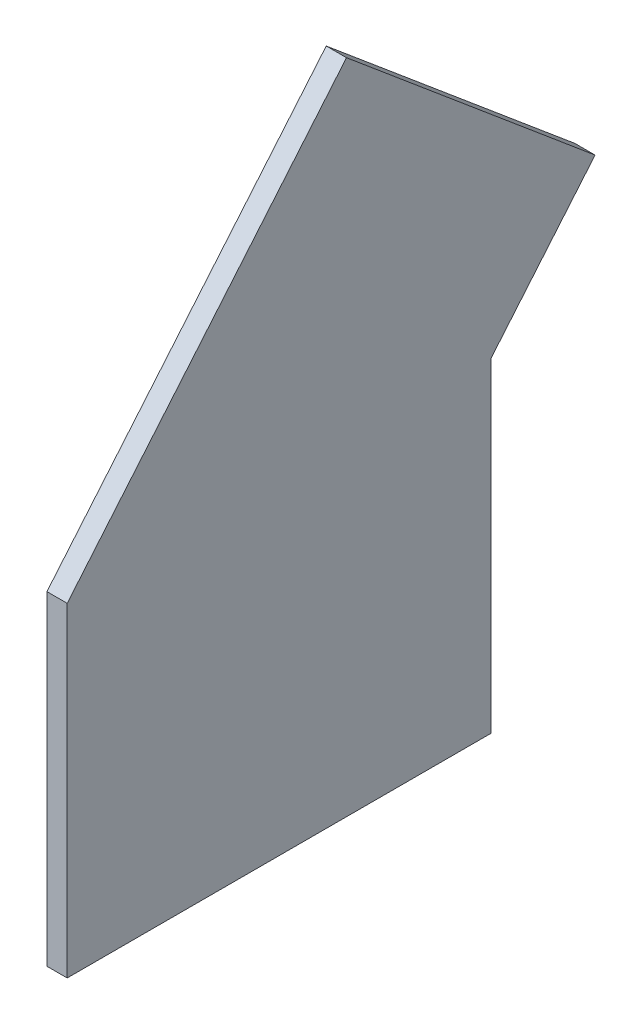
from build123d import *

# Parameters (mm, degrees)
BOSS_EXTRUDE1_DEPTH = 3.175


with BuildPart() as part:
    # Sketch1 → Boss-Extrude1 (new body)
    with BuildSketch(Plane(origin=(0, 0, 0), x_dir=(0, 0, -1), z_dir=(1, 0, 0))):
        Polygon((0, 0), (0, 50.8), (16.326805286, 70.257528855), (-22.588252424, 102.911139427), (-66.314690298, 50.8), (-66.314690298, 0), align=None)
    extrude(amount=BOSS_EXTRUDE1_DEPTH)


solid = part.part
